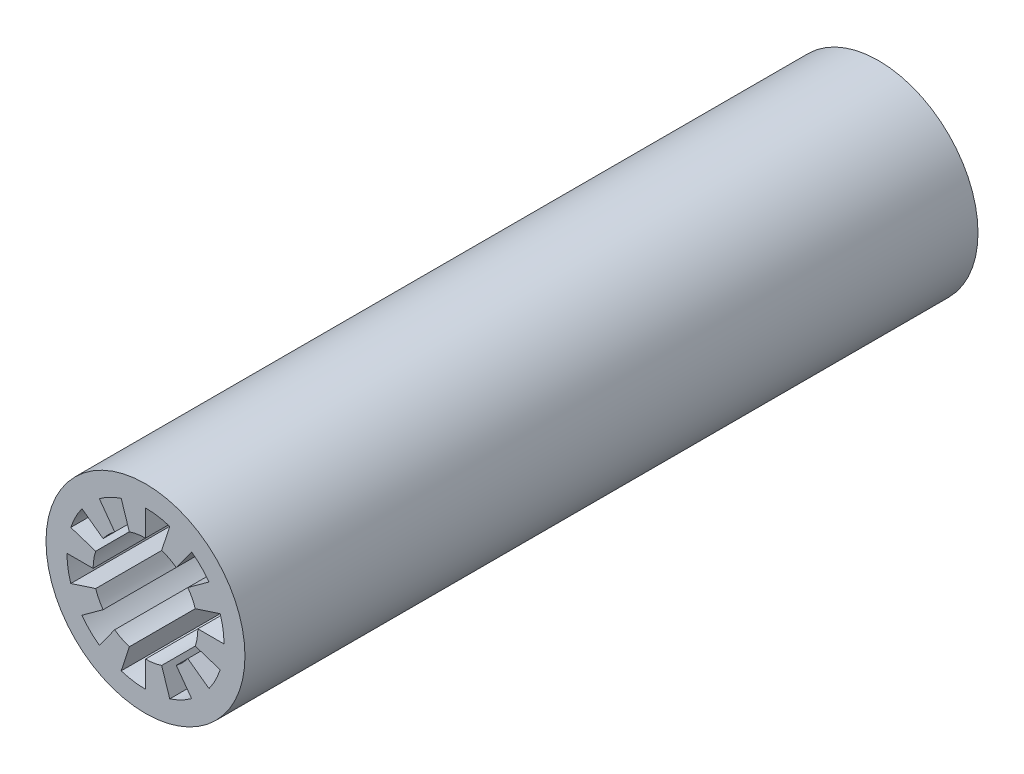
from build123d import *

# Parameters (mm, degrees)
SKETCH_1_R      = 9.5
EXTRUDE_1_DEPTH = 70


with BuildPart() as part:
    # Эскиз1 → Бобышка-Вытянуть1 (new body)
    with BuildSketch(Plane.XY):
        Circle(SKETCH_1_R)
        with BuildLine():
            Line((0, 7.5), (0, 5))
            ThreePointArc((0, 5), (-0.782172325, 4.938441703), (-1.545084972, 4.755282581))
            Line((-1.545084972, 4.755282581), (-2.317627458, 7.132923872))
            ThreePointArc((-2.317627458, 7.132923872), (-3.404928748, 6.682548931), (-4.408389392, 6.067627458))
            Line((-4.408389392, 6.067627458), (-2.938926261, 4.045084972))
            ThreePointArc((-2.938926261, 4.045084972), (-3.535533906, 3.535533906), (-4.045084972, 2.938926261))
            Line((-4.045084972, 2.938926261), (-6.067627458, 4.408389392))
            ThreePointArc((-6.067627458, 4.408389392), (-6.682548931, 3.404928748), (-7.132923872, 2.317627458))
            Line((-7.132923872, 2.317627458), (-4.755282581, 1.545084972))
            ThreePointArc((-4.755282581, 1.545084972), (-4.938441703, 0.782172325), (-5, 0))
            Line((-5, 0), (-7.5, 0))
            ThreePointArc((-7.5, 0), (-7.407662554, -1.173258488), (-7.132923872, -2.317627458))
            Line((-7.132923872, -2.317627458), (-4.755282581, -1.545084972))
            ThreePointArc((-4.755282581, -1.545084972), (-4.455032621, -2.269952499), (-4.045084972, -2.938926261))
            Line((-4.045084972, -2.938926261), (-6.067627458, -4.408389392))
            ThreePointArc((-6.067627458, -4.408389392), (-5.303300859, -5.303300859), (-4.408389392, -6.067627458))
            Line((-4.408389392, -6.067627458), (-2.938926261, -4.045084972))
            ThreePointArc((-2.938926261, -4.045084972), (-2.269952499, -4.455032621), (-1.545084972, -4.755282581))
            Line((-1.545084972, -4.755282581), (-2.317627458, -7.132923872))
            ThreePointArc((-2.317627458, -7.132923872), (-1.173258488, -7.407662554), (0, -7.5))
            Line((0, -7.5), (0, -5))
            ThreePointArc((0, -5), (0.782172325, -4.938441703), (1.545084972, -4.755282581))
            Line((1.545084972, -4.755282581), (2.317627458, -7.132923872))
            ThreePointArc((2.317627458, -7.132923872), (3.404928748, -6.682548931), (4.408389392, -6.067627458))
            Line((4.408389392, -6.067627458), (2.938926261, -4.045084972))
            ThreePointArc((2.938926261, -4.045084972), (3.535533906, -3.535533906), (4.045084972, -2.938926261))
            Line((4.045084972, -2.938926261), (6.067627458, -4.408389392))
            ThreePointArc((6.067627458, -4.408389392), (6.682548931, -3.404928748), (7.132923872, -2.317627458))
            Line((7.132923872, -2.317627458), (4.755282581, -1.545084972))
            ThreePointArc((4.755282581, -1.545084972), (4.938441703, -0.782172325), (5, 0))
            Line((5, 0), (7.5, 0))
            ThreePointArc((7.5, 0), (7.407662554, 1.173258488), (7.132923872, 2.317627458))
            Line((7.132923872, 2.317627458), (4.755282581, 1.545084972))
            ThreePointArc((4.755282581, 1.545084972), (4.455032621, 2.269952499), (4.045084972, 2.938926261))
            Line((4.045084972, 2.938926261), (6.067627458, 4.408389392))
            ThreePointArc((6.067627458, 4.408389392), (5.303300859, 5.303300859), (4.408389392, 6.067627458))
            Line((4.408389392, 6.067627458), (2.938926261, 4.045084972))
            ThreePointArc((2.938926261, 4.045084972), (2.269952499, 4.455032621), (1.545084972, 4.755282581))
            Line((1.545084972, 4.755282581), (2.317627458, 7.132923872))
            ThreePointArc((2.317627458, 7.132923872), (1.173258488, 7.407662554), (0, 7.5))
        make_face(mode=Mode.SUBTRACT)
    extrude(amount=EXTRUDE_1_DEPTH)


solid = part.part
